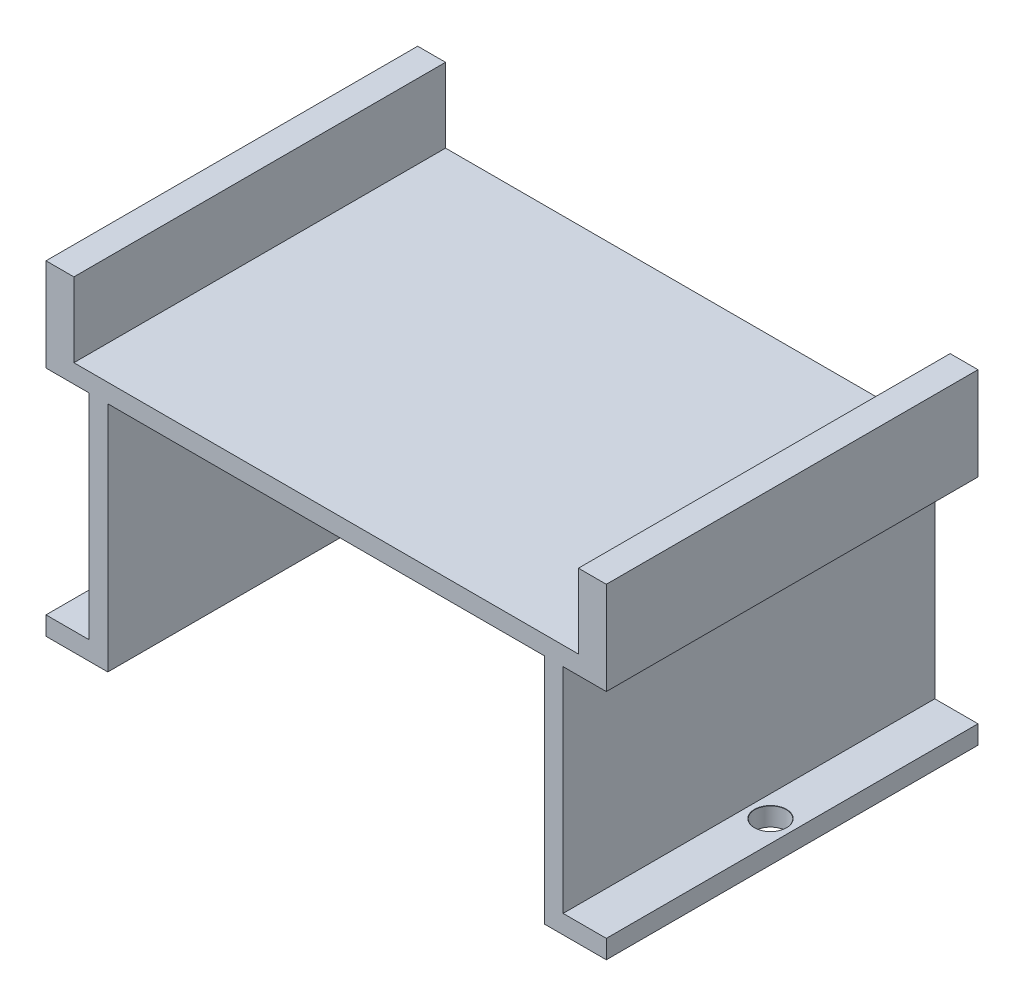
from build123d import *

# Parameters (mm, degrees)
SKETCH1_W                      = 60.3
SKETCH1_H                      = 35
BOSS_EXTRUDE1_DEPTH            = 40
SKETCH2_W                      = 47
SKETCH2_H                      = 25
SKETCH2_W_2                    = 54.3
SKETCH2_H_2                    = 8
SKETCH2_W_3                    = 4.65
SKETCH2_H_3                    = 23
CUT_EXTRUDE1_DEPTH             = 54.059141531
M3_CLEARANCE_HOLE2_D           = 3.4
M3_CLEARANCE_HOLE2_DEPTH       = 2
M3_CLEARANCE_HOLE2_CSINK_D     = 3.45
M3_CLEARANCE_HOLE2_CSINK_ANGLE = 90
M3_CLEARANCE_HOLE3_D           = 3.4
M3_CLEARANCE_HOLE3_DEPTH       = 2
M3_CLEARANCE_HOLE3_CSINK_D     = 3.45
M3_CLEARANCE_HOLE3_CSINK_ANGLE = 90


with BuildPart() as part:
    # Sketch1 → Boss-Extrude1 (new body)
    with BuildSketch(Plane.XY):
        Rectangle(SKETCH1_W, SKETCH1_H)
    extrude(amount=BOSS_EXTRUDE1_DEPTH)

    # Sketch2 → Cut-Extrude1 (cut, through all)
    with BuildSketch(Plane(origin=(0, 0, 0), x_dir=(-1, 0, 0), z_dir=(0, 0, -1))):
        with Locations((0, -5)):
            Rectangle(SKETCH2_W, SKETCH2_H)
        with Locations((0, 13.5)):
            Rectangle(SKETCH2_W_2, SKETCH2_H_2)
        with Locations((-27.825, -4)):
            Rectangle(SKETCH2_W_3, SKETCH2_H_3)
        with Locations((27.825, -4)):
            Rectangle(SKETCH2_W_3, SKETCH2_H_3)
    extrude(amount=-CUT_EXTRUDE1_DEPTH, mode=Mode.SUBTRACT)

    # M3 Clearance Hole2
    with Locations(Plane(origin=(0, -15.5, 0), x_dir=(1, 0, 0), z_dir=(0, 1, 0))):
        with Locations((-27.82, -20)):
            CounterSinkHole(M3_CLEARANCE_HOLE2_D / 2, M3_CLEARANCE_HOLE2_CSINK_D / 2, depth=M3_CLEARANCE_HOLE2_DEPTH, counter_sink_angle=M3_CLEARANCE_HOLE2_CSINK_ANGLE)

    # M3 Clearance Hole3
    with Locations(Plane(origin=(0, -15.5, 0), x_dir=(1, 0, 0), z_dir=(0, 1, 0))):
        with Locations((27.82, -20)):
            CounterSinkHole(M3_CLEARANCE_HOLE3_D / 2, M3_CLEARANCE_HOLE3_CSINK_D / 2, depth=M3_CLEARANCE_HOLE3_DEPTH, counter_sink_angle=M3_CLEARANCE_HOLE3_CSINK_ANGLE)


solid = part.part
